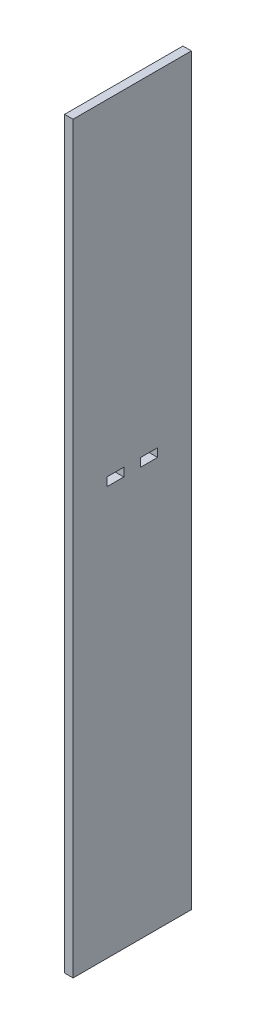
from build123d import *

# Parameters (mm, degrees)
SKETCH2_W           = 6.35
SKETCH2_H           = 88.9
BOSS_EXTRUDE1_DEPTH = 558.8
SKETCH3_W           = 12.7
SKETCH3_H           = 6.35
CUT_EXTRUDE1_DEPTH  = 561.60107474


with BuildPart() as part:
    # Sketch2 → Boss-Extrude1 (new body)
    with BuildSketch(Plane(origin=(0, 0, 0), x_dir=(1, 0, 0), z_dir=(0, 1, 0))):
        with Locations((-41.275, 0)):
            Rectangle(SKETCH2_W, SKETCH2_H)
    extrude(amount=BOSS_EXTRUDE1_DEPTH)

    # Sketch3 → Cut-Extrude1 (cut, through all)
    with BuildSketch(Plane.ZY.offset(44.45)):
        with Locations((-12.7, 310.13)):
            Rectangle(SKETCH3_W, SKETCH3_H)
        with Locations((12.7, 310.13)):
            Rectangle(SKETCH3_W, SKETCH3_H)
    extrude(amount=-CUT_EXTRUDE1_DEPTH, mode=Mode.SUBTRACT)


solid = part.part
